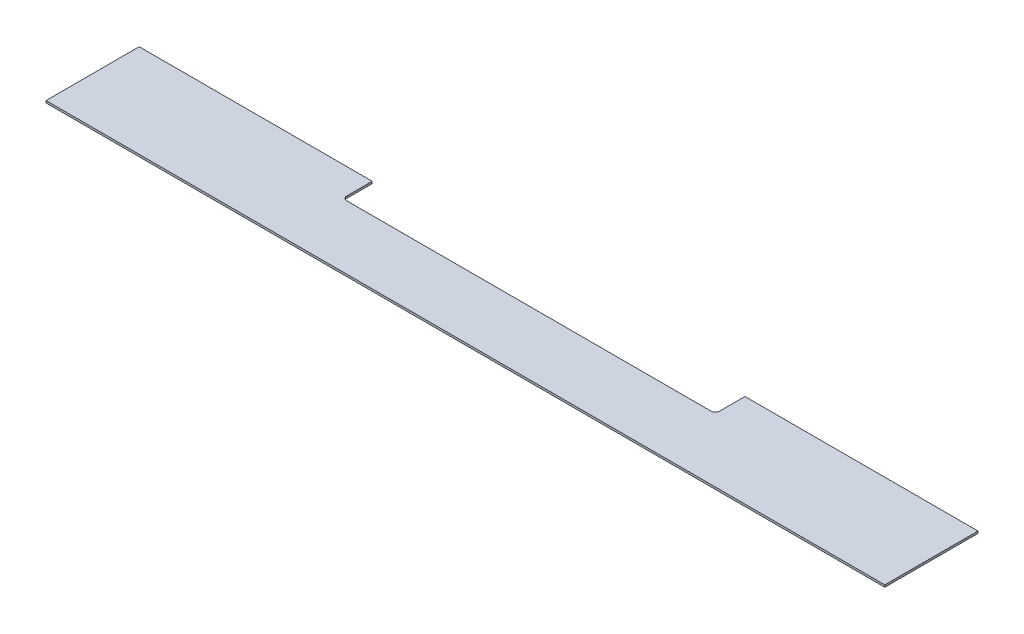
from build123d import *

# Parameters (mm, degrees)
SKETCH1_W           = 1257.3
SKETCH1_H           = 139.7
BOSS_EXTRUDE1_DEPTH = 3.175
SKETCH2_W           = 558.8
SKETCH2_H           = 44.45
CUT_EXTRUDE1_DEPTH  = 1266.041288111
FILLET1_R           = 6.35


with BuildPart() as part:
    # Sketch1 → Boss-Extrude1 (new body)
    with BuildSketch(Plane(origin=(0, 0, 0), x_dir=(1, 0, 0), z_dir=(0, 1, 0))):
        with Locations((628.65, 69.85)):
            Rectangle(SKETCH1_W, SKETCH1_H)
    extrude(amount=BOSS_EXTRUDE1_DEPTH)

    # Sketch2 → Cut-Extrude1 (cut, through all)
    with BuildSketch(Plane(origin=(0, 3.175, 0), x_dir=(1, 0, 0), z_dir=(0, 1, 0))):
        with Locations((628.65, 117.475)):
            Rectangle(SKETCH2_W, SKETCH2_H)
    extrude(amount=-CUT_EXTRUDE1_DEPTH, mode=Mode.SUBTRACT)

    # Fillet1
    fillet1_edges = [part.edges().sort_by_distance(p)[0] for p in [
        (349.25, 1.5875, -95.25),
        (908.05, 1.5875, -95.25),
    ]]
    fillet(fillet1_edges, radius=FILLET1_R)


solid = part.part
